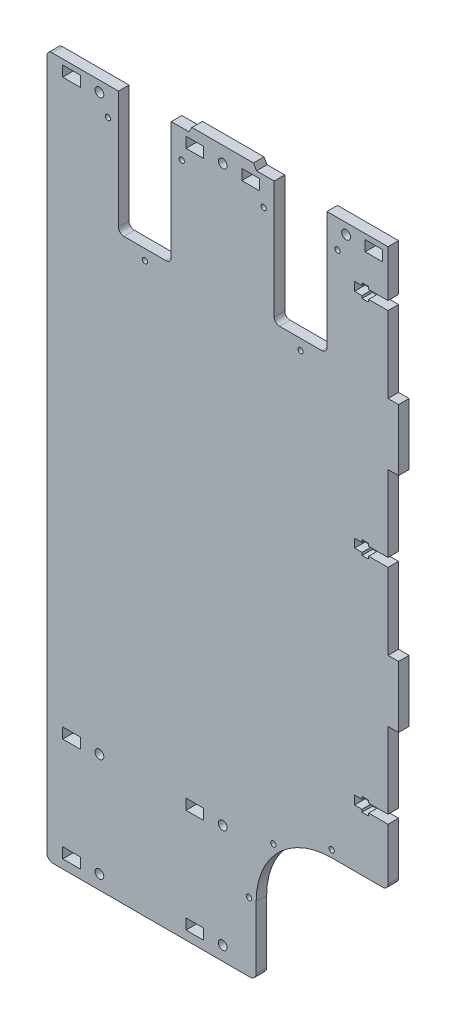
from build123d import *

# Parameters (mm, degrees)
SKETCH_1_R               = 2.5
SKETCH_1_R_2             = 1.5
SKETCH_1_W               = 10
SKETCH_1_H               = 6
EXTRUDE_1_DEPTH          = 6
FILLET_1_R               = 3.5
FILLET_2_R               = 3
CUT_EXTRUDE_1_DEPTH      = 403.661147865
CUT_EXTRUDE_1_DEPTH_BACK = 403.661147865
SKETCH_2_R               = 1.5


with BuildPart() as part:
    # Эскиз1 → Бобышка-Вытянуть1 (new body)
    with BuildSketch(Plane.XY):
        with BuildLine():
            Line((94, -65.75), (94, -22.45))
            Line((94, -22.45), (83, -22.45))
            Line((83, -22.45), (83, -23.925))
            Line((83, -23.925), (79.2, -23.925))
            Line((79.2, -23.925), (79.2, -22.45))
            Line((79.2, -22.45), (75, -22.45))
            Line((75, -22.45), (75, -17.55))
            Line((75, -17.55), (79.2, -17.55))
            Line((79.2, -17.55), (79.2, -16.075))
            Line((79.2, -16.075), (83, -16.075))
            Line((83, -16.075), (83, -17.55))
            Line((83, -17.55), (94, -17.55))
            Line((94, -17.55), (94, 9))
            Line((94, 9), (59.275, 9))
            Line((59.275, 9), (59.275, -61))
            Line((59.275, -61), (29.275, -61))
            Line((29.275, -61), (29.275, 9))
            Line((29.275, 9), (19.232050808, 9))
            Line((19.232050808, 9), (17.5, 12))
            Line((17.5, 12), (-17.5, 12))
            Line((-17.5, 12), (-19.232050808, 9))
            Line((-19.232050808, 9), (-29.275, 9))
            Line((-29.275, 9), (-29.275, -61))
            Line((-29.275, -61), (-59.275, -61))
            Line((-59.275, -61), (-59.275, 9))
            Line((-59.275, 9), (-100, 9))
            Line((-100, 9), (-100, -390))
            Line((-100, -390), (19, -390))
            Line((19, -390), (19, -351))
            ThreePointArc((19, -351), (31.594408409, -320.594408409), (62, -308))
            Line((62, -308), (94, -308))
            Line((94, -308), (94, -275.45))
            Line((94, -275.45), (83, -275.45))
            Line((83, -275.45), (83, -276.925))
            Line((83, -276.925), (79.2, -276.925))
            Line((79.2, -276.925), (79.2, -275.45))
            Line((79.2, -275.45), (75, -275.45))
            Line((75, -275.45), (75, -270.55))
            Line((75, -270.55), (79.2, -270.55))
            Line((79.2, -270.55), (79.2, -269.075))
            Line((79.2, -269.075), (83, -269.075))
            Line((83, -269.075), (83, -270.55))
            Line((83, -270.55), (94, -270.55))
            Line((94, -270.55), (94, -227.25))
            Line((94, -227.25), (100, -227.25))
            Line((100, -227.25), (100, -192.25))
            Line((100, -192.25), (94, -192.25))
            Line((94, -192.25), (94, -148.95))
            Line((94, -148.95), (83, -148.95))
            Line((83, -148.95), (83, -150.425))
            Line((83, -150.425), (79.2, -150.425))
            Line((79.2, -150.425), (79.2, -148.95))
            Line((79.2, -148.95), (75, -148.95))
            Line((75, -148.95), (75, -144.05))
            Line((75, -144.05), (79.2, -144.05))
            Line((79.2, -144.05), (79.2, -142.575))
            Line((79.2, -142.575), (83, -142.575))
            Line((83, -142.575), (83, -144.05))
            Line((83, -144.05), (94, -144.05))
            Line((94, -144.05), (94, -100.75))
            Line((94, -100.75), (100, -100.75))
            Line((100, -100.75), (100, -65.75))
            Line((100, -65.75), (94, -65.75))
        make_face()
        with Locations((-70.1375, 3)):
            Circle(SKETCH_1_R, mode=Mode.SUBTRACT)
        with Locations((0, 3)):
            Circle(SKETCH_1_R, mode=Mode.SUBTRACT)
        with Locations(Location((70.1375, 3, 0), (0, 0, 180))):
            Circle(SKETCH_1_R, mode=Mode.SUBTRACT)
        with Locations((-70.1375, -382)):
            Circle(SKETCH_1_R, mode=Mode.SUBTRACT)
        with Locations((0, -382)):
            Circle(SKETCH_1_R, mode=Mode.SUBTRACT)
        with Locations((-70.1375, -323)):
            Circle(SKETCH_1_R, mode=Mode.SUBTRACT)
        with Locations((0, -323)):
            Circle(SKETCH_1_R, mode=Mode.SUBTRACT)
        with Locations((-44.275, -67)):
            Circle(SKETCH_1_R_2, mode=Mode.SUBTRACT)
        with Locations((-65.275, -7)):
            Circle(SKETCH_1_R_2, mode=Mode.SUBTRACT)
        with Locations(Location((-23.275, -7, 0), (0, 0, 180))):
            Circle(SKETCH_1_R_2, mode=Mode.SUBTRACT)
        with Locations(Location((44.275, -67, 0), (0, 0, 180))):
            Circle(SKETCH_1_R_2, mode=Mode.SUBTRACT)
        with Locations((23.275, -7)):
            Circle(SKETCH_1_R_2, mode=Mode.SUBTRACT)
        with Locations(Location((65.275, -7, 0), (0, 0, 180))):
            Circle(SKETCH_1_R_2, mode=Mode.SUBTRACT)
        with Locations((15.8625, 3)):
            Rectangle(SKETCH_1_W, SKETCH_1_H, mode=Mode.SUBTRACT)
        with Locations((-15.8625, 3)):
            Rectangle(SKETCH_1_W, SKETCH_1_H, mode=Mode.SUBTRACT)
        with Locations((-86, 3)):
            Rectangle(SKETCH_1_W, SKETCH_1_H, mode=Mode.SUBTRACT)
        with Locations((86, 3)):
            Rectangle(SKETCH_1_W, SKETCH_1_H, mode=Mode.SUBTRACT)
        with Locations((-86, -382)):
            Rectangle(SKETCH_1_W, SKETCH_1_H, mode=Mode.SUBTRACT)
        with Locations((-15.8625, -382)):
            Rectangle(SKETCH_1_W, SKETCH_1_H, mode=Mode.SUBTRACT)
        with Locations((-86, -323)):
            Rectangle(SKETCH_1_W, SKETCH_1_H, mode=Mode.SUBTRACT)
        with Locations((-15.8625, -323)):
            Rectangle(SKETCH_1_W, SKETCH_1_H, mode=Mode.SUBTRACT)
    extrude(amount=EXTRUDE_1_DEPTH)

    # Скругление1
    fillet_1_edges = [part.edges().sort_by_distance(p)[0] for p in [
        (19, -390, 3),
        (-100, -390, 3),
    ]]
    fillet(fillet_1_edges, radius=FILLET_1_R)

    # Скругление2
    fillet_2_edges = [part.edges().sort_by_distance(p)[0] for p in [
        (94, -308, 3),
        (-100, 9, 3),
        (-59.275, -61, 3),
        (-29.275, -61, 3),
        (29.275, -61, 3),
        (59.275, -61, 3),
    ]]
    fillet(fillet_2_edges, radius=FILLET_2_R)

    # Эскиз2 → Вырез-Вытянуть1 (cut, two sides: drawn at the far end of the back side and taken through both)
    with BuildSketch(Plane.XY.offset(6).offset(-CUT_EXTRUDE_1_DEPTH_BACK)):
        with Locations((15, -351)):
            Circle(SKETCH_2_R)
        with Locations((28.765981284, -317.765981284)):
            Circle(SKETCH_2_R)
        with Locations((62, -304)):
            Circle(SKETCH_2_R)
    extrude(amount=CUT_EXTRUDE_1_DEPTH + CUT_EXTRUDE_1_DEPTH_BACK, mode=Mode.SUBTRACT)


solid = part.part
